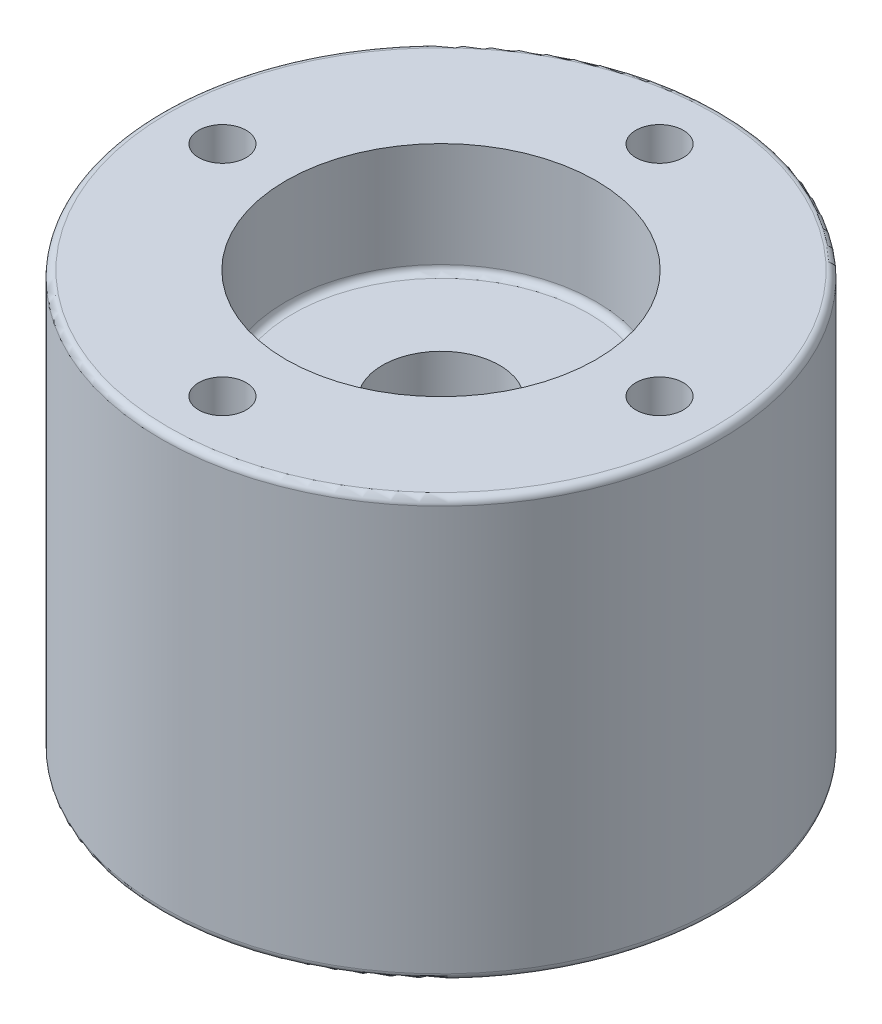
from build123d import *

# Parameters (mm, degrees)
SKETCH2_R           = 20
BOSS_EXTRUDE1_DEPTH = 30
SKETCH3_R           = 11.1
CUT_EXTRUDE1_DEPTH  = 8
CUT_EXTRUDE2_START  = -8
SKETCH4_R           = 11.1
CUT_EXTRUDE2_DEPTH  = 8
SKETCH5_R           = 1.7
CUT_EXTRUDE3_DEPTH  = 42.231056256
SKETCH6_R           = 4.2
CUT_EXTRUDE4_DEPTH  = 36.832945734
FILLET1_R           = 0.5
FILLET2_R           = 0.5


with BuildPart() as part:
    # Sketch2 → Boss-Extrude1 (new body)
    with BuildSketch(Plane(origin=(0, 0, 0), x_dir=(1, 0, 0), z_dir=(0, 1, 0))):
        with Locations(Location((0, 0, 0), (0, 0, 270))):
            Circle(SKETCH2_R)
    extrude(amount=BOSS_EXTRUDE1_DEPTH)

    # Sketch3 → Cut-Extrude1 (cut)
    with BuildSketch(Plane(origin=(0, 30, 0), x_dir=(1, 0, 0), z_dir=(0, 1, 0))):
        with Locations(Location((0, 0, 0), (0, 0, 270))):
            Circle(SKETCH3_R)
    extrude(amount=-CUT_EXTRUDE1_DEPTH, mode=Mode.SUBTRACT)

    # Sketch4 → Cut-Extrude2 (cut)
    with BuildSketch(Plane(origin=(0, 0, 0), x_dir=(-1, 0, 0), z_dir=(0, -1, 0)).offset(CUT_EXTRUDE2_START)):
        with Locations(Location((0, 0, 0), (0, 0, 270))):
            Circle(SKETCH4_R)
    extrude(amount=CUT_EXTRUDE2_DEPTH, mode=Mode.SUBTRACT)

    # Sketch5 → Cut-Extrude3 (cut, through all)
    with BuildSketch(Plane(origin=(0, 30, 0), x_dir=(1, 0, 0), z_dir=(0, 1, 0))):
        with Locations(Location((0, 15.65, 0), (0, 0, 270))):
            Circle(SKETCH5_R)
        with Locations(Location((-15.65, 0, 0), (0, 0, 270))):
            Circle(SKETCH5_R)
        with Locations(Location((0, -15.65, 0), (0, 0, 270))):
            Circle(SKETCH5_R)
        with Locations(Location((15.65, 0, 0), (0, 0, 270))):
            Circle(SKETCH5_R)
    extrude(amount=-CUT_EXTRUDE3_DEPTH, mode=Mode.SUBTRACT)

    # Sketch6 → Cut-Extrude4 (cut, through all)
    with BuildSketch(Plane(origin=(0, 22, 0), x_dir=(1, 0, 0), z_dir=(0, 1, 0))):
        with Locations(Location((0, 0, 0), (0, 0, 270))):
            Circle(SKETCH6_R)
    extrude(amount=-CUT_EXTRUDE4_DEPTH, mode=Mode.SUBTRACT)

    # Fillet1
    fillet1_edges = [part.edges().sort_by_distance(p)[0] for p in [
        (0, 22, -11.1),
    ]]
    fillet(fillet1_edges, radius=FILLET1_R)

    # Fillet2
    fillet2_edges = [part.edges().sort_by_distance(p)[0] for p in [
        (0, 8, -11.1),
        (0, 0, -11.1),
        (0, 0, -20),
        (0, 30, -20),
    ]]
    fillet(fillet2_edges, radius=FILLET2_R)


solid = part.part
